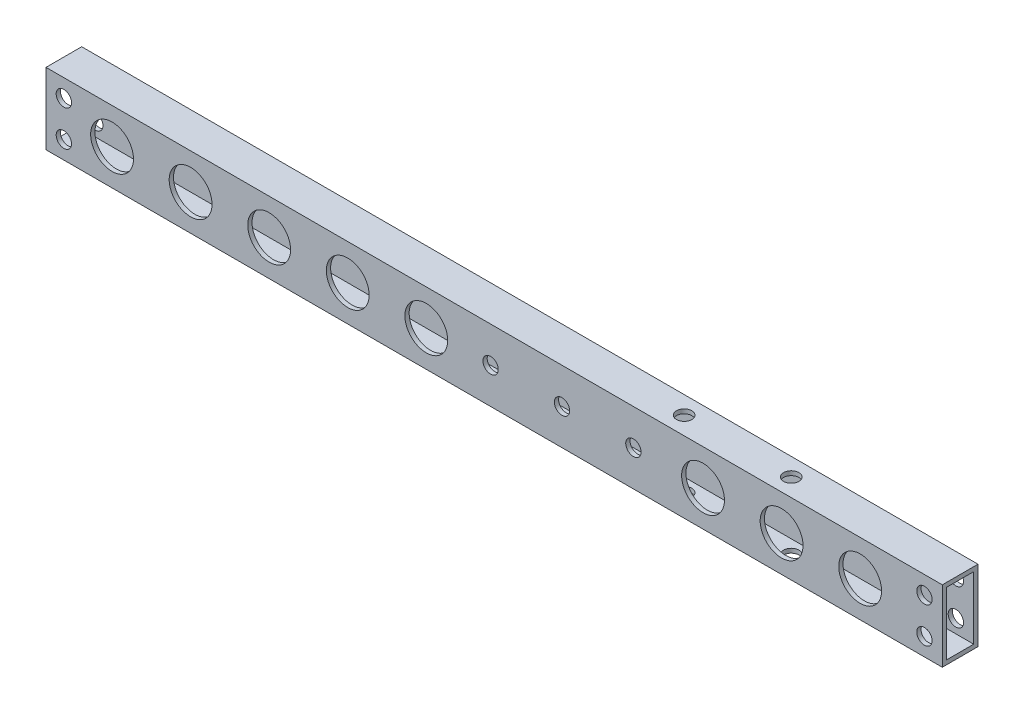
from build123d import *

# Parameters (mm, degrees)
SKETCH_1_W          = 10
SKETCH_1_H          = 20
SKETCH_1_W_2        = 7.6
SKETCH_1_H_2        = 17.6
EXTRUDE_1_DEPTH     = 350
SKETCH_2_R          = 2.15
SKETCH_2_R_2        = 6
CUT_EXTRUDE_1_DEPTH = 351.285597763
SKETCH_3_R          = 3.175
SKETCH_3_R_2        = 2.15
CUT_EXTRUDE_2_DEPTH = 351.606617165
CUT_EXTRUDE_3_REACH = 352.286
SKETCH_4_W          = 99
SKETCH_4_H          = 20


with BuildPart() as part:
    # ｽｹｯﾁ1 → 押し出し-薄板1 (new body)
    with BuildSketch(Plane(origin=(0, 0, 0), x_dir=(0, 0, -1), z_dir=(1, 0, 0))):
        Rectangle(SKETCH_1_W, SKETCH_1_H)
        Rectangle(SKETCH_1_W_2, SKETCH_1_H_2, mode=Mode.SUBTRACT)
    extrude(amount=EXTRUDE_1_DEPTH)

    # ｽｹｯﾁ2 → ｶｯﾄ - 押し出し1 (cut, through all)
    with BuildSketch(Plane.XY.offset(5)):
        with Locations((246, 5)):
            Circle(SKETCH_2_R)
        with Locations(Location((246, -5, 0), (0, 0, 90))):
            Circle(SKETCH_2_R)
        with Locations((5, -5)):
            Circle(SKETCH_2_R)
        with Locations(Location((5, 5, 0), (0, 0, 90))):
            Circle(SKETCH_2_R)
        with Locations((164.5, 0)):
            Circle(SKETCH_2_R)
        with Locations((144.5, 0)):
            Circle(SKETCH_2_R)
        with Locations((124.5, 0)):
            Circle(SKETCH_2_R)
        with Locations((330, 0)):
            Circle(SKETCH_2_R_2)
        with Locations((308, 0)):
            Circle(SKETCH_2_R_2)
        with Locations((286, 0)):
            Circle(SKETCH_2_R_2)
        with Locations((264, 0)):
            Circle(SKETCH_2_R_2)
        with Locations((228, 0)):
            Circle(SKETCH_2_R_2)
        with Locations((206, 0)):
            Circle(SKETCH_2_R_2)
        with Locations((184, 0)):
            Circle(SKETCH_2_R_2)
        with Locations((106.5, 0)):
            Circle(SKETCH_2_R_2)
        with Locations((84.5, 0)):
            Circle(SKETCH_2_R_2)
        with Locations((62.5, 0)):
            Circle(SKETCH_2_R_2)
        with Locations((40.5, 0)):
            Circle(SKETCH_2_R_2)
        with Locations((18.5, 0)):
            Circle(SKETCH_2_R_2)
    extrude(amount=-CUT_EXTRUDE_1_DEPTH, mode=Mode.SUBTRACT)

    # ｽｹｯﾁ3 → ｶｯﾄ - 押し出し2 (cut, through all)
    with BuildSketch(Plane(origin=(0, 10, 0), x_dir=(1, 0, 0), z_dir=(0, 1, 0))):
        with Locations(Location((343.25, 0, 0), (0, 0, 270))):
            Circle(SKETCH_3_R)
        with Locations(Location((173.7, 0, 0), (0, 0, 270))):
            Circle(SKETCH_3_R_2)
        with Locations(Location((203.7, 0, 0), (0, 0, 270))):
            Circle(SKETCH_3_R_2)
    extrude(amount=-CUT_EXTRUDE_2_DEPTH, mode=Mode.SUBTRACT)

    # ｶｯﾄ - 押し出し3: up to this face of the body (flat: up to its plane)
    cut_extrude_3_end = Plane(part.part.faces().sort_by_distance((175.381114236, 0, -5))[0])
    # ｽｹｯﾁ4 → ｶｯﾄ - 押し出し3 (cut, up to the picked face)
    with BuildSketch(Plane.XY.offset(5), mode=Mode.PRIVATE) as cut_extrude_3_sk1:
        with Locations((300.5, 0)):
            Rectangle(SKETCH_4_W, SKETCH_4_H)
    cut_extrude_3_tool1 = split(extrude(cut_extrude_3_sk1.sketch, amount=-CUT_EXTRUDE_3_REACH, mode=Mode.PRIVATE), bisect_by=cut_extrude_3_end, keep=Keep.BOTH, mode=Mode.PRIVATE)
    add(cut_extrude_3_tool1.solids().sort_by(Axis((300.5, 0, 5), (0, 0, -1)))[0], mode=Mode.SUBTRACT)


solid = part.part
